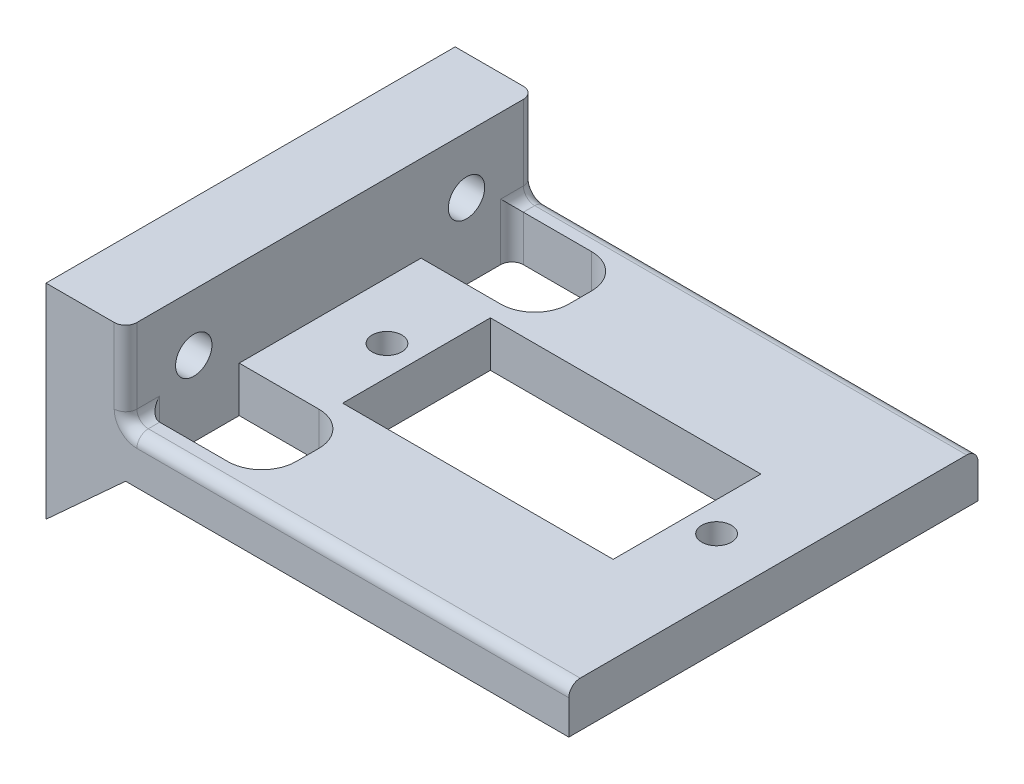
from build123d import *

# Parameters (mm, degrees)
SERVO_SHELF_START                = 21.4
SERVO_SHELF_PROFILE_W            = 46
SERVO_SHELF_PROFILE_H            = 36
SERVO_SHELF_DEPTH                = 4
REAR_CLAMPING_BLOCK_START        = -18
REAR_CLAMPING_BLOCK_PROFILE_W    = 7
REAR_CLAMPING_BLOCK_PROFILE_H    = 10
REAR_CLAMPING_BLOCK_DEPTH        = 36
SERVO_BODY_WINDOW_START          = 20.4
SERVO_BODY_WINDOW_PROFILE_W      = 23.8
SERVO_BODY_WINDOW_PROFILE_H      = 13
SERVO_BODY_WINDOW_DEPTH          = 25.744213361
YAW_SERVO_M2_FASTENERS_START     = 20.4
YAW_SERVO_M2_FASTENERS_PROFILE_R = 1.3
YAW_SERVO_M2_FASTENERS_DEPTH     = 25.744213361
LEFT_NUT_ACCESS_START            = 20
LEFT_NUT_ACCESS_PROFILE_W        = 10
LEFT_NUT_ACCESS_PROFILE_H        = 8
LEFT_NUT_ACCESS_DEPTH            = 26.144213361
RIGHT_NUT_ACCESS_START           = 20
RIGHT_NUT_ACCESS_PROFILE_W       = 10
RIGHT_NUT_ACCESS_PROFILE_H       = 8
RIGHT_NUT_ACCESS_DEPTH           = 26.144213361
REAR_CLAMPING_M3_HOLES_START     = -25
REAR_CLAMPING_M3_PROFILE_R       = 1.6
REAR_CLAMPING_M3_HOLES_DEPTH     = 11
FILLET1_R                        = 3
FILLET2_R                        = 1
BOSS_EXTRUDE1_START              = -36
BOSS_EXTRUDE1_DEPTH              = 36


with BuildPart() as part:
    # Servo_shelf_profile → Servo_shelf (new body)
    with BuildSketch(Plane(origin=(0, 0, 0), x_dir=(1, 0, 0), z_dir=(0, 1, 0)).offset(SERVO_SHELF_START)):
        with Locations((2, 0)):
            Rectangle(SERVO_SHELF_PROFILE_W, SERVO_SHELF_PROFILE_H)
    extrude(amount=SERVO_SHELF_DEPTH)

    # Rear_clamping_block_profile → Rear_clamping_block (add)
    with BuildSketch(Plane.XY.offset(REAR_CLAMPING_BLOCK_START)):
        with Locations((-17.5, 28)):
            Rectangle(REAR_CLAMPING_BLOCK_PROFILE_W, REAR_CLAMPING_BLOCK_PROFILE_H)
    extrude(amount=REAR_CLAMPING_BLOCK_DEPTH)

    # Servo_body_window_profile → Servo_body_window (cut, through all)
    with BuildSketch(Plane(origin=(0, 0, 0), x_dir=(1, 0, 0), z_dir=(0, 1, 0)).offset(SERVO_BODY_WINDOW_START)):
        with Locations((5.5, 0)):
            Rectangle(SERVO_BODY_WINDOW_PROFILE_W, SERVO_BODY_WINDOW_PROFILE_H)
    extrude(amount=SERVO_BODY_WINDOW_DEPTH, mode=Mode.SUBTRACT)

    # Yaw_servo_M2_fasteners_profile → Yaw_servo_M2_fasteners (cut, through all)
    with BuildSketch(Plane(origin=(0, 0, 0), x_dir=(1, 0, 0), z_dir=(0, 1, 0)).offset(YAW_SERVO_M2_FASTENERS_START)):
        with Locations(Location((-9, 0, 0), (0, 0, 90))):
            Circle(YAW_SERVO_M2_FASTENERS_PROFILE_R)
        with Locations(Location((20, 0, 0), (0, 0, 90))):
            Circle(YAW_SERVO_M2_FASTENERS_PROFILE_R)
    extrude(amount=YAW_SERVO_M2_FASTENERS_DEPTH, mode=Mode.SUBTRACT)

    # Left_nut_access_profile → Left_nut_access (cut, through all)
    with BuildSketch(Plane(origin=(0, 0, 0), x_dir=(1, 0, 0), z_dir=(0, 1, 0)).offset(LEFT_NUT_ACCESS_START)):
        with Locations((-9, 12)):
            Rectangle(LEFT_NUT_ACCESS_PROFILE_W, LEFT_NUT_ACCESS_PROFILE_H)
    extrude(amount=LEFT_NUT_ACCESS_DEPTH, mode=Mode.SUBTRACT)

    # Right_nut_access_profile → Right_nut_access (cut, through all)
    with BuildSketch(Plane(origin=(0, 0, 0), x_dir=(1, 0, 0), z_dir=(0, 1, 0)).offset(RIGHT_NUT_ACCESS_START)):
        with Locations((-9, -12)):
            Rectangle(RIGHT_NUT_ACCESS_PROFILE_W, RIGHT_NUT_ACCESS_PROFILE_H)
    extrude(amount=RIGHT_NUT_ACCESS_DEPTH, mode=Mode.SUBTRACT)

    # Rear_clamping_M3_profile → Rear_clamping_M3_holes (cut)
    with BuildSketch(Plane(origin=(0, 0, 0), x_dir=(0, 0, -1), z_dir=(1, 0, 0)).offset(REAR_CLAMPING_M3_HOLES_START)):
        with Locations((12, 28)):
            Circle(REAR_CLAMPING_M3_PROFILE_R)
        with Locations((-12, 28)):
            Circle(REAR_CLAMPING_M3_PROFILE_R)
    extrude(amount=REAR_CLAMPING_M3_HOLES_DEPTH, mode=Mode.SUBTRACT)

    # Fillet1
    fillet1_edges = [part.edges().sort_by_distance(p)[0] for p in [
        (-4, 23.4, 16),
        (-4, 23.4, 8),
        (-4, 23.4, -8),
        (-4, 23.4, -16),
    ]]
    fillet(fillet1_edges, radius=FILLET1_R)

    # Fillet2
    fillet2_edges = [part.edges().sort_by_distance(p)[0] for p in [
        (-14, 23.4, 16),
        (5.5, 25.4, 18),
        (-14, 25.4, 17),
        (5.5, 25.4, -18),
        (-14, 29.2, 18),
        (-14, 29.2, -18),
        (-14, 25.4, -17),
        (-14, 23.4, -16),
    ]]
    fillet(fillet2_edges, radius=FILLET2_R)

    # Sketch1 → Boss-Extrude1 (add)
    with BuildSketch(Plane(origin=(0, 0, -18), x_dir=(-1, 0, 0), z_dir=(0, 0, -1)).offset(BOSS_EXTRUDE1_START)):
        Polygon((14, 21.4), (21, 15), (21, 21.4), align=None)
    extrude(amount=BOSS_EXTRUDE1_DEPTH)


solid = part.part
